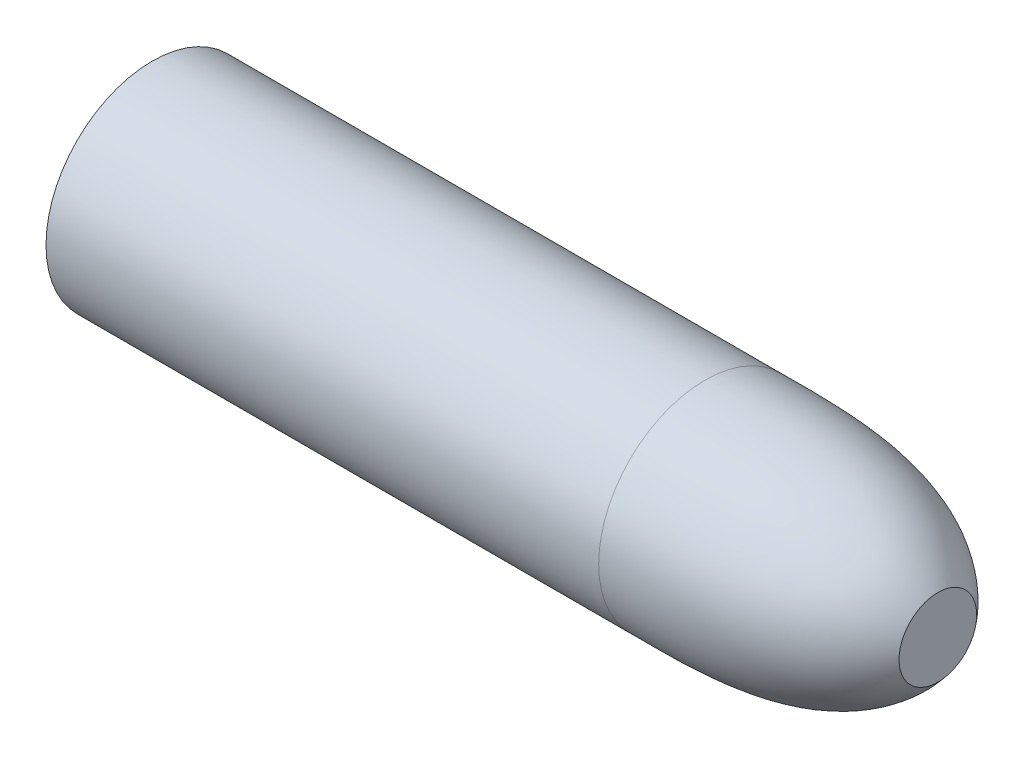
from build123d import *


with BuildPart() as part:
    # Sketch1 → Revolve3 (revolve)
    with BuildSketch(Plane.XY, mode=Mode.PRIVATE) as revolve3_sk:
        with BuildLine():
            Line((0, 0), (0, 34.75))
            Line((0, 34.75), (180.8, 34.75))
            add(Edge.make_bspline(
                [(180.8, 34.75), (206.626858967, 34.88327905), (239.01534692, 35.392284316), (257, 12.7)],
                knots=[0, 0, 0, 0, 1, 1, 1, 1], degree=3))
            Line((257, 12.7), (257, 0))
            Line((257, 0), (0, 0))
        make_face()
    revolve(revolve3_sk.sketch.rotate(Axis((0, 0, 0), (1, 0, 0)), 90), axis=Axis((0, 0, 0), (1, 0, 0)))


solid = part.part
